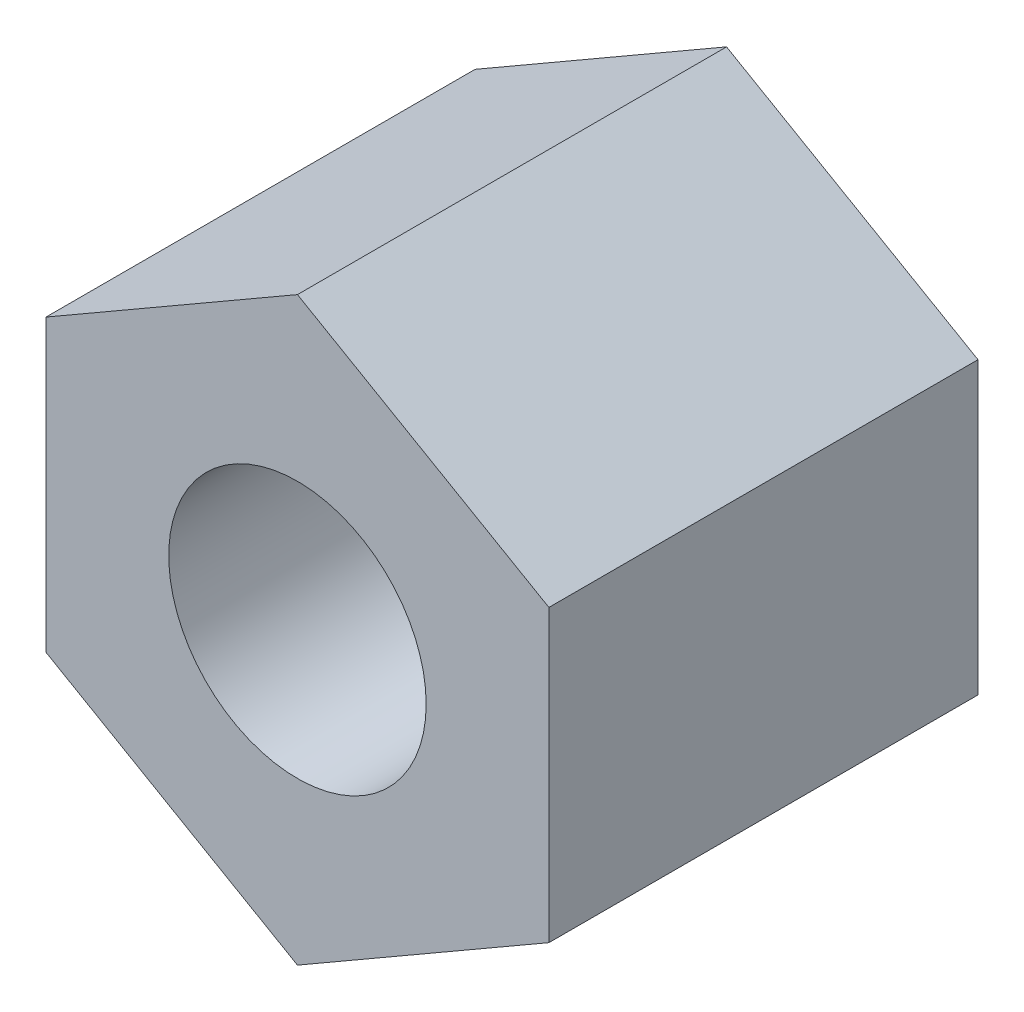
from build123d import *

# Parameters (mm, degrees)
ESQUISSE1_R        = 1.5
BOSS_EXTRU_1_DEPTH = 5


with BuildPart() as part:
    # Esquisse1 → Boss.-Extru.1 (new body)
    with BuildSketch(Plane.XY):
        Polygon((0, -3.383272577), (2.93, -1.691636289), (2.93, 1.691636289), (0, 3.383272577), (-2.93, 1.691636289), (-2.93, -1.691636289), align=None)
        Circle(ESQUISSE1_R, mode=Mode.SUBTRACT)
    extrude(amount=BOSS_EXTRU_1_DEPTH)


solid = part.part
